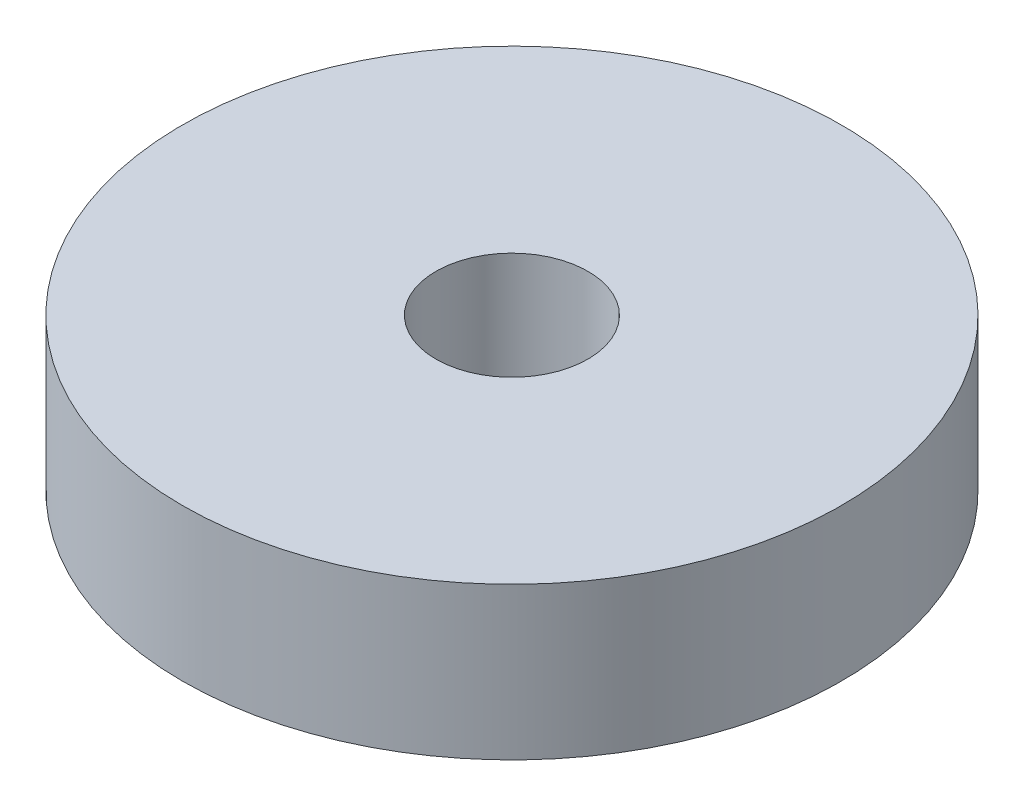
from build123d import *

# Parameters (mm, degrees)
SKETCH1_R           = 6.5
SKETCH1_R_2         = 1.5
BOSS_EXTRUDE1_DEPTH = 3


with BuildPart() as part:
    # Sketch1 → Boss-Extrude1 (new body)
    with BuildSketch(Plane(origin=(0, 0, 0), x_dir=(1, 0, 0), z_dir=(0, 1, 0))):
        with Locations(Location((0, 0, 0), (0, 0, 270))):
            Circle(SKETCH1_R)
        with Locations(Location((0, 0, 0), (0, 0, 270))):
            Circle(SKETCH1_R_2, mode=Mode.SUBTRACT)
    extrude(amount=BOSS_EXTRUDE1_DEPTH)


solid = part.part
